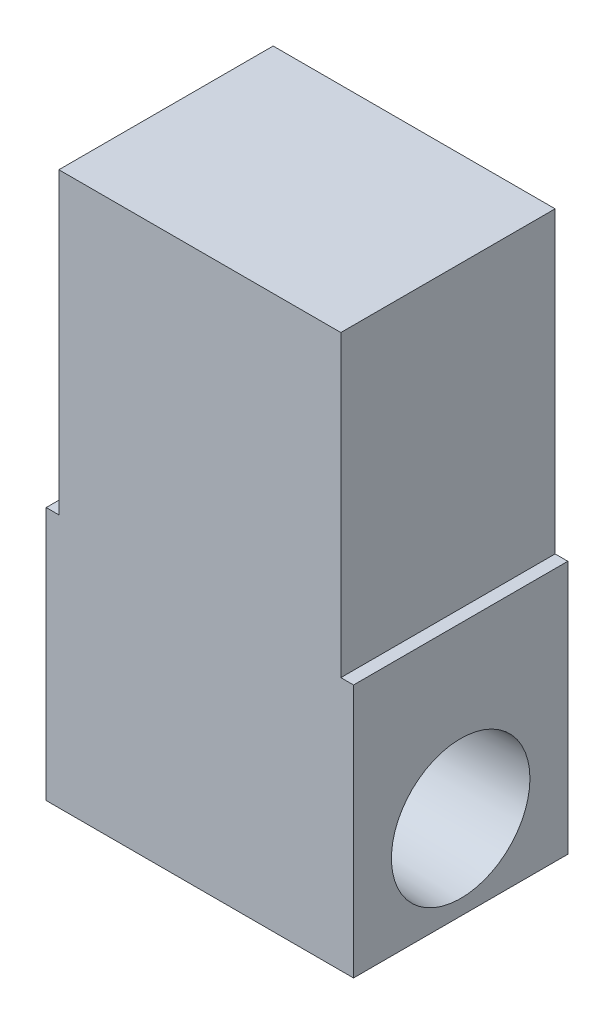
from build123d import *

# Parameters (mm, degrees)
SKETCH1_W           = 27.686
SKETCH1_H           = 22.86
SKETCH1_W_2         = 25.4
SKETCH1_H_2         = 26.924
BOSS_EXTRUDE1_DEPTH = 19.304


with BuildPart() as part:
    # Sketch1 → Boss-Extrude1 (new body)
    with BuildSketch(Plane.XY):
        Rectangle(SKETCH1_W, SKETCH1_H)
        with Locations((0, 24.892)):
            Rectangle(SKETCH1_W_2, SKETCH1_H_2)
    extrude(amount=BOSS_EXTRUDE1_DEPTH)

    # Sketch3 → 1/4 NPT Tapped Hole1 (revolve, cut)
    with BuildSketch(Plane(origin=(13.843, -3.81, 9.652), x_dir=(0, 0, -1), z_dir=(0, 1, 0))):
        Polygon((0, 0), (0, 13.502347279), (5.5626, 10.16), (5.5626, 9.906), (5.943685794, 9.906), (6.2402847, 0), align=None)
    revolve(axis=Axis((20.193, -3.81, 9.652), (-1, 0, 0)), mode=Mode.SUBTRACT)

    # Sketch4 → 1/4 NPT Tapped Hole2 (revolve, cut)
    with BuildSketch(Plane(origin=(-13.843, -3.81, 9.652), x_dir=(0, 0, 1), z_dir=(0, 1, 0))):
        Polygon((0, 0), (0, 13.502347279), (5.5626, 10.16), (5.5626, 9.906), (5.943685794, 9.906), (6.2402847, 0), align=None)
    revolve(axis=Axis((-20.193, -3.81, 9.652), (1, 0, 0)), mode=Mode.SUBTRACT)


solid = part.part
